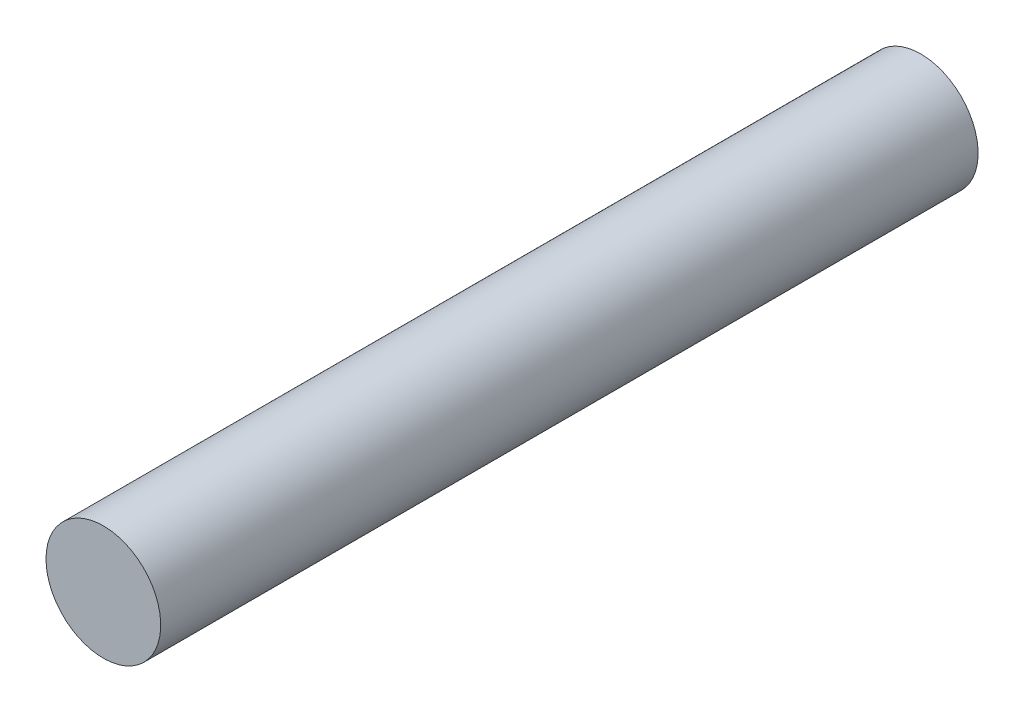
from build123d import *

# Parameters (mm, degrees)
SKETCH_1_R      = 4
EXTRUDE_1_DEPTH = 57


with BuildPart() as part:
    # Эскиз1 → Вытянуть1 (new body)
    with BuildSketch(Plane.XY):
        with Locations(Location((0, 0, 0), (0, 0, 180))):
            Circle(SKETCH_1_R)
    extrude(amount=EXTRUDE_1_DEPTH)


solid = part.part
